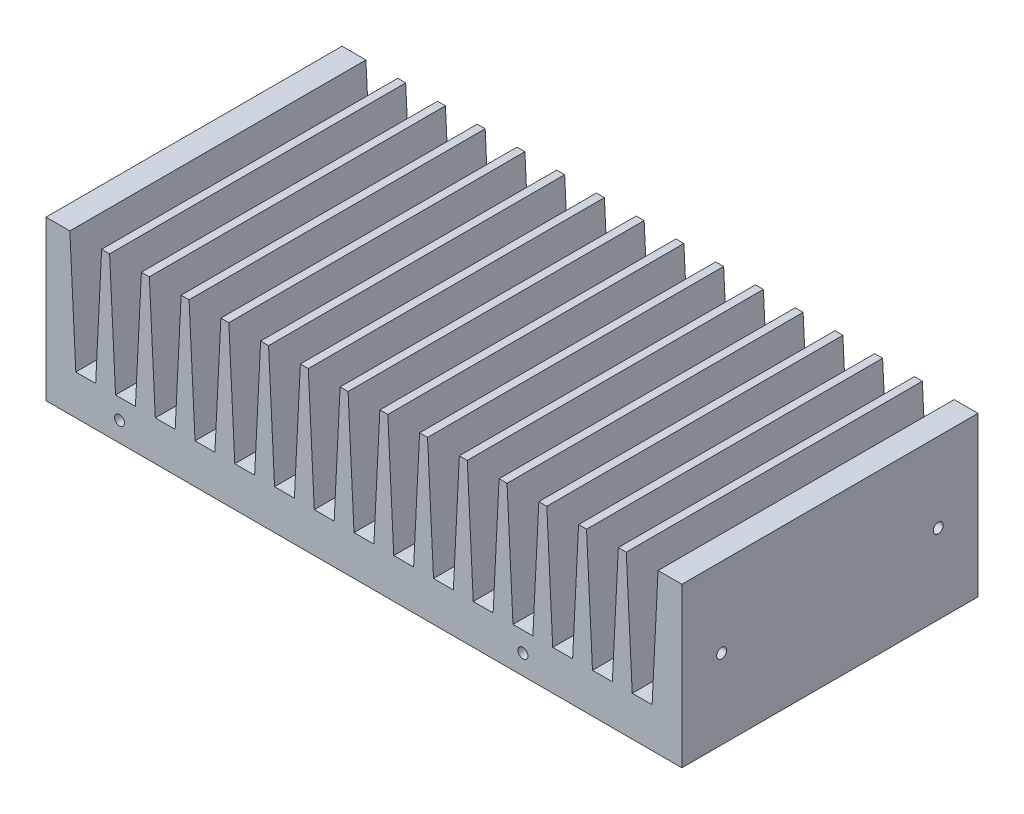
from build123d import *

# Parameters (mm, degrees)
BOSS_EXTRUDE1_DEPTH = 74.5
SKETCH2_R           = 1.25
CUT_EXTRUDE1_DEPTH  = 10
SKETCH3_R           = 1.25
CUT_EXTRUDE2_DEPTH  = 10
SKETCH4_R           = 1.25
CUT_EXTRUDE3_DEPTH  = 15
CUT_EXTRUDE4_START  = -15
SKETCH5_R           = 1.25
CUT_EXTRUDE4_DEPTH  = 15


with BuildPart() as part:
    # Sketch1 → Boss-Extrude1 (new body)
    with BuildSketch(Plane.XY):
        Polygon((0, 0), (0, 40), (6, 40), (7.5, 10), (12.5, 10), (14, 40), (16, 40), (17.5, 10), (22.5, 10), (24, 40), (26, 40), (27.5, 10), (32.5, 10), (34, 40), (36, 40), (37.5, 10), (42.5, 10), (44, 40), (46, 40), (47.5, 10), (52.5, 10), (54, 40), (56, 40), (57.5, 10), (62.5, 10), (64, 40), (66, 40), (67.5, 10), (72.5, 10), (74, 40), (76, 40), (77.5, 10), (82.5, 10), (84, 40), (86, 40), (87.5, 10), (92.5, 10), (94, 40), (96, 40), (97.5, 10), (102.5, 10), (104, 40), (106, 40), (107.5, 10), (112.5, 10), (114, 40), (116, 40), (117.5, 10), (122.5, 10), (124, 40), (126, 40), (127.5, 10), (132.5, 10), (134, 40), (136, 40), (137.5, 10), (142.5, 10), (144, 40), (146, 40), (147.5, 10), (152.5, 10), (154, 40), (160, 40), (160, 0), align=None)
    extrude(amount=BOSS_EXTRUDE1_DEPTH)

    # Sketch2 → Cut-Extrude1 (cut)
    with BuildSketch(Plane(origin=(160, 0, 0), x_dir=(0, 0, -1), z_dir=(1, 0, 0))):
        with Locations((-64.5, 20)):
            Circle(SKETCH2_R)
        with Locations((-10, 20)):
            Circle(SKETCH2_R)
    extrude(amount=-CUT_EXTRUDE1_DEPTH, mode=Mode.SUBTRACT)

    # Sketch3 → Cut-Extrude2 (cut)
    with BuildSketch(Plane.ZY):
        with Locations((20, 20)):
            Circle(SKETCH3_R)
        with Locations((54.5, 20)):
            Circle(SKETCH3_R)
    extrude(amount=-CUT_EXTRUDE2_DEPTH, mode=Mode.SUBTRACT)

    # Sketch4 → Cut-Extrude3 (cut)
    with BuildSketch(Plane.XY.offset(74.5)):
        with Locations((18.5, 5)):
            Circle(SKETCH4_R)
        with Locations((120, 5)):
            Circle(SKETCH4_R)
    extrude(amount=-CUT_EXTRUDE3_DEPTH, mode=Mode.SUBTRACT)

    # Sketch5 → Cut-Extrude4 (cut)
    with BuildSketch(Plane(origin=(0, 0, 0), x_dir=(-1, 0, 0), z_dir=(0, 0, -1)).offset(CUT_EXTRUDE4_START)):
        with Locations(Location((-120, 5, 0), (0, 0, 180))):
            Circle(SKETCH5_R)
        with Locations(Location((-18.5, 5, 0), (0, 0, 180))):
            Circle(SKETCH5_R)
    extrude(amount=CUT_EXTRUDE4_DEPTH, mode=Mode.SUBTRACT)


solid = part.part
